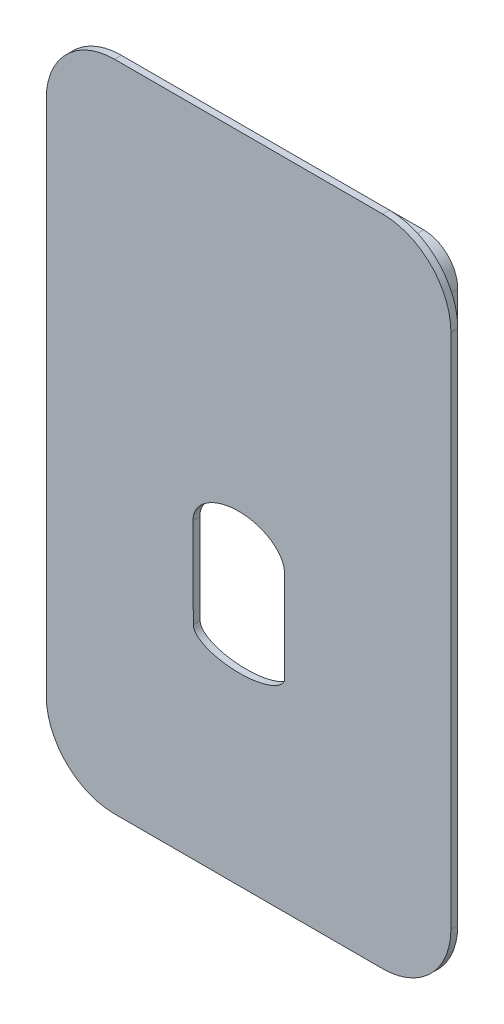
from build123d import *

# Parameters (mm, degrees)
BOSS_EXTRUDE1_DEPTH     = 2
BOSS_EXTRUDE2_DEPTH     = 10
CUT_EXTRUDE1_DEPTH      = 119.595420067
CUT_EXTRUDE1_DEPTH_BACK = 119.595420067


with BuildPart() as part:
    # Sketch1 → Boss-Extrude1 (new body)
    with BuildSketch(Plane.XY):
        with BuildLine():
            Line((-48.55615004, 95.168805411), (29.960861776, 95.168805411))
            ThreePointArc((29.960861776, 95.168805411), (44.1029974, 89.310941035), (49.960861776, 75.168805411))
            Line((49.960861776, 75.168805411), (49.960861776, -76.254495753))
            ThreePointArc((49.960861776, -76.254495753), (44.1029974, -90.396631376), (29.960861776, -96.254495753))
            Line((29.960861776, -96.254495753), (-48.556149966, -96.254495753))
            ThreePointArc((-48.556149966, -96.254495753), (-62.698285587, -90.39663138), (-68.556149966, -76.254495762))
            Line((-68.556149966, -76.254495762), (-68.55615004, 75.168805401))
            ThreePointArc((-68.55615004, 75.168805401), (-62.698285667, 89.310941031), (-48.55615004, 95.168805411))
        make_face()
    extrude(amount=BOSS_EXTRUDE1_DEPTH)

    # Sketch1<3> → Boss-Extrude2 (add)
    with BuildSketch(Plane.XY):
        with BuildLine():
            Line((29.960861776, 85.168805411), (-48.55615004, 85.168805411))
            ThreePointArc((-48.55615004, 85.168805411), (-55.627217853, 82.239873221), (-58.55615004, 75.168805406))
            Line((-58.55615004, 75.168805406), (-58.556149982, -44.933857006))
            ThreePointArc((-58.556149982, -44.933857006), (-55.627217792, -52.004924815), (-48.556149982, -54.933857001))
            Line((-48.556149982, -54.933857001), (29.960861776, -54.933857001))
            ThreePointArc((29.960861776, -54.933857001), (37.031929588, -52.004924813), (39.960861776, -44.933857001))
            Line((39.960861776, -44.933857001), (39.960861776, 75.168805411))
            ThreePointArc((39.960861776, 75.168805411), (37.031929588, 82.239873223), (29.960861776, 85.168805411))
        make_face()
        with BuildLine():
            ThreePointArc((-56.55615004, 75.168805407), (-54.213004291, 80.825659659), (-48.55615004, 83.168805411))
            Line((-48.55615004, 83.168805411), (29.960861776, 83.168805411))
            ThreePointArc((29.960861776, 83.168805411), (35.617716026, 80.82565966), (37.960861776, 75.168805411))
            Line((37.960861776, 75.168805411), (37.960861776, -44.933856987))
            ThreePointArc((37.960861776, -44.933856987), (35.617716026, -50.590711236), (29.960861776, -52.933856987))
            Line((29.960861776, -52.933856987), (-48.556149982, -52.933856987))
            ThreePointArc((-48.556149982, -52.933856987), (-54.21300423, -50.590711237), (-56.556149982, -44.93385699))
            Line((-56.556149982, -44.93385699), (-56.55615004, 75.168805407))
        make_face(mode=Mode.SUBTRACT)
    extrude(amount=-BOSS_EXTRUDE2_DEPTH)

    # Sketch3 → Cut-Extrude1 (cut, two sides: drawn at the far end of the back side and taken through both)
    with BuildSketch(Plane(origin=(0, 0, 0), x_dir=(-1, 0, 0), z_dir=(0, 0, -1)).offset(-CUT_EXTRUDE1_DEPTH_BACK)):
        with BuildLine():
            Line((25.489402973, -36.700798798), (25.595818918, -10.417445008))
            add(Edge.make_bspline(
                [(25.595818918, -10.417445008), (25.595818918, -1.296173206), (12.173879387, -1.295746312), (-1.248060145, -1.295319417), (-1.249316495, -10.416591179)],
                knots=[0, 0, 0, 1.570749525, 1.570749525, 3.141499049, 3.141499049, 3.141499049], degree=2, weights=[1, 0.707123328, 1, 0.707123328, 1]))
            Line((-1.249316495, -10.416591179), (-1.253050558, -37.527526675))
            add(Edge.make_bspline(
                [(-1.253050558, -37.527526675), (0.598808841, -42.641507472), (13.044105907, -42.256768128), (25.489402973, -41.872028784), (25.489402973, -36.700798798)],
                knots=[0.148937555, 0.148937555, 0.148937555, 1.645265104, 1.645265104, 3.141592654, 3.141592654, 3.141592654], degree=2, weights=[1, 0.732939277, 1, 0.732939277, 1]))
        make_face()
    extrude(amount=CUT_EXTRUDE1_DEPTH + CUT_EXTRUDE1_DEPTH_BACK, mode=Mode.SUBTRACT)


solid = part.part
